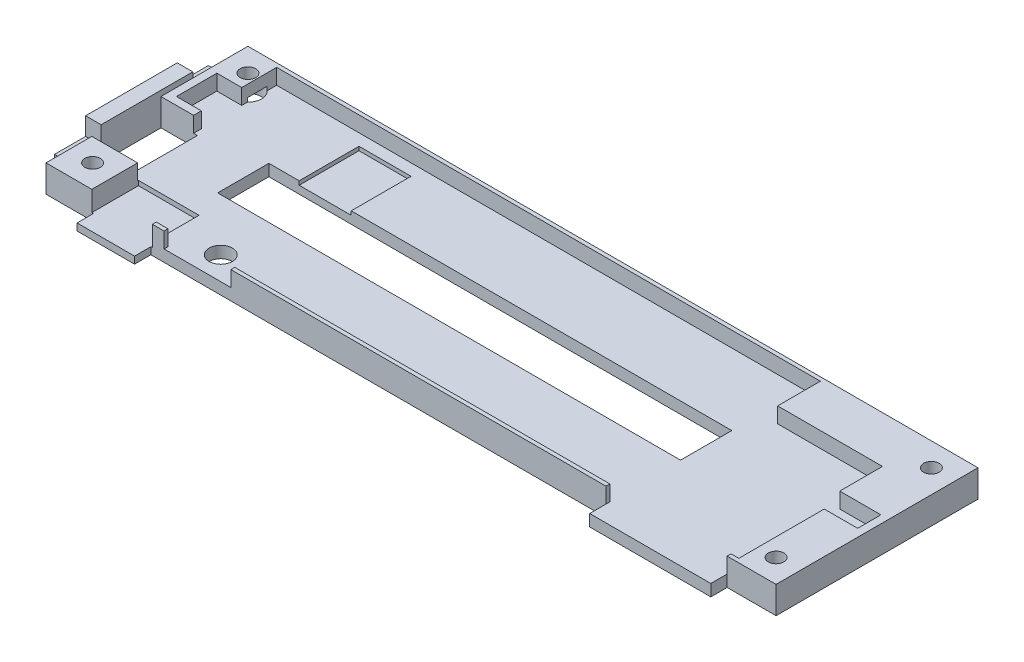
from build123d import *

# Parameters (mm, degrees)
SKETCH_1_W           = 94
SKETCH_1_H           = 26
SKETCH_1_R           = 1
EXTRUDE_1_DEPTH      = 3.5
SKETCH_2_W           = 4.7
SKETCH_2_H           = 8.9
SKETCH_2_W_2         = 59.6
SKETCH_2_H_2         = 6.6
CUT_EXTRUDE_1_DEPTH  = 49.890183064
SKETCH_3_R           = 1.5
CUT_EXTRUDE_2_DEPTH  = 49.890183064
SKETCH_4_R           = 1.75
CUT_EXTRUDE_3_DEPTH  = 2
SKETCH_5_W           = 7.8
SKETCH_5_H           = 2.6
SKETCH_5_W_2         = 8.6
SKETCH_5_H_2         = 2
CUT_EXTRUDE_4_DEPTH  = 6
SKETCH_5_3_W         = 15.6
SKETCH_5_3_H         = 2
CUT_EXTRUDE_5_DEPTH  = 20
SKETCH_6_W           = 70
SKETCH_6_H           = 19.6
SKETCH_6_W_2         = 18.8
SKETCH_6_H_2         = 3
SKETCH_6_W_3         = 82.8
SKETCH_6_H_3         = 11
SKETCH_6_W_4         = 3.2
SKETCH_6_H_4         = 5.2
CUT_EXTRUDE_12_DEPTH = 2
SKETCH_7_W           = 6.7
SKETCH_7_H           = 7.7
CUT_EXTRUDE_13_DEPTH = 0.5
SKETCH_8_W           = 7.4
SKETCH_8_H           = 0.9
SKETCH_8_W_2         = 15.6
SKETCH_8_H_2         = 1.5
EXTRUDE_2_DEPTH      = 2.1
SKETCH_10_W          = 19.8
SKETCH_10_H          = 1.9
SKETCH_10_W_2        = 11.8
SKETCH_10_H_2        = 4.2
EXTRUDE_3_DEPTH      = 2


with BuildPart() as part:
    # 草图1 → 凸台-拉伸1 (new body)
    with BuildSketch(Plane(origin=(0, 0, 0), x_dir=(1, 0, 0), z_dir=(0, 1, 0))):
        Rectangle(SKETCH_1_W, SKETCH_1_H)
        with Locations(Location((-44, 10, 0), (0, 0, 270))):
            Circle(SKETCH_1_R, mode=Mode.SUBTRACT)
        with Locations(Location((-44, -10, 0), (0, 0, 270))):
            Circle(SKETCH_1_R, mode=Mode.SUBTRACT)
        with Locations(Location((44, 10, 0), (0, 0, 270))):
            Circle(SKETCH_1_R, mode=Mode.SUBTRACT)
        with Locations(Location((44, -10, 0), (0, 0, 270))):
            Circle(SKETCH_1_R, mode=Mode.SUBTRACT)
    extrude(amount=EXTRUDE_1_DEPTH)

    # 草图2 → 切除-拉伸1 (cut, through all)
    with BuildSketch(Plane.XZ):
        with Locations((-44.65, 2.65)):
            Rectangle(SKETCH_2_W, SKETCH_2_H)
        with Locations((-4.8, 0)):
            Rectangle(SKETCH_2_W_2, SKETCH_2_H_2)
    extrude(amount=-CUT_EXTRUDE_1_DEPTH, mode=Mode.SUBTRACT)

    # 草图3 → 切除-拉伸2 (cut, through all)
    with BuildSketch(Plane(origin=(0, 0, 0), x_dir=(-1, 0, 0), z_dir=(0, -1, 0))):
        with Locations(Location((27.5, -10, 0), (0, 0, 90))):
            Circle(SKETCH_3_R)
    extrude(amount=-CUT_EXTRUDE_2_DEPTH, mode=Mode.SUBTRACT)

    # 草图4 → 切除-拉伸3 (cut)
    with BuildSketch(Plane.XZ):
        with Locations(Location((-44, 10, 0), (0, 0, 270))):
            Circle(SKETCH_4_R)
        with Locations(Location((-44, -10, 0), (0, 0, 270))):
            Circle(SKETCH_4_R)
        with Locations(Location((44, 10, 0), (0, 0, 270))):
            Circle(SKETCH_4_R)
        with Locations(Location((44, -10, 0), (0, 0, 270))):
            Circle(SKETCH_4_R)
    extrude(amount=-CUT_EXTRUDE_3_DEPTH, mode=Mode.SUBTRACT)

    # 草图5 → 切除-拉伸4 (cut)
    with BuildSketch(Plane.XY.offset(13)):
        with Locations((-37.2, 2.2)):
            Rectangle(SKETCH_5_W, SKETCH_5_H)
        with Locations((-27.5, 2.5)):
            Rectangle(SKETCH_5_W_2, SKETCH_5_H_2)
    extrude(amount=-CUT_EXTRUDE_4_DEPTH, mode=Mode.SUBTRACT)

    # 草图5<3> → 切除-拉伸5 (cut)
    with BuildSketch(Plane.XY.offset(13)):
        with Locations((32.9, 2.5)):
            Rectangle(SKETCH_5_3_W, SKETCH_5_3_H)
    extrude(amount=-CUT_EXTRUDE_5_DEPTH, mode=Mode.SUBTRACT)

    # 草图6 → 切除-拉伸12 (cut)
    with BuildSketch(Plane(origin=(0, 3.5, 0), x_dir=(1, 0, 0), z_dir=(0, 1, 0))):
        with Locations((-7.8, 2.7)):
            Rectangle(SKETCH_6_W, SKETCH_6_H)
        with Locations((36.6, 0)):
            Rectangle(SKETCH_6_W_2, SKETCH_6_H_2)
        with Locations((0.3, -7)):
            Rectangle(SKETCH_6_W_3, SKETCH_6_H_3)
        with Locations((-44.4, 5.4)):
            Rectangle(SKETCH_6_W_4, SKETCH_6_H_4)
    extrude(amount=-CUT_EXTRUDE_12_DEPTH, mode=Mode.SUBTRACT)

    # 草图7 → 切除-拉伸13 (cut)
    with BuildSketch(Plane(origin=(0, 1.5, 0), x_dir=(1, 0, 0), z_dir=(0, 1, 0))):
        with Locations((-27.35, 7.15)):
            Rectangle(SKETCH_7_W, SKETCH_7_H)
    extrude(amount=-CUT_EXTRUDE_13_DEPTH, mode=Mode.SUBTRACT)

    # 草图8 → 凸台-拉伸2 (add)
    with BuildSketch(Plane.XY.offset(13)):
        with Locations((-37.2, 0.45)):
            Rectangle(SKETCH_8_W, SKETCH_8_H)
        with Locations((32.9, 0.75)):
            Rectangle(SKETCH_8_W_2, SKETCH_8_H_2)
    extrude(amount=EXTRUDE_2_DEPTH)

    # 草图10 → 凸台-拉伸3 (add)
    with BuildSketch(Plane.ZY.offset(47)):
        with Locations((0, 0.95)):
            Rectangle(SKETCH_10_W, SKETCH_10_H)
        with Locations((0, 2.1)):
            Rectangle(SKETCH_10_W_2, SKETCH_10_H_2)
    extrude(amount=EXTRUDE_3_DEPTH)


solid = part.part
